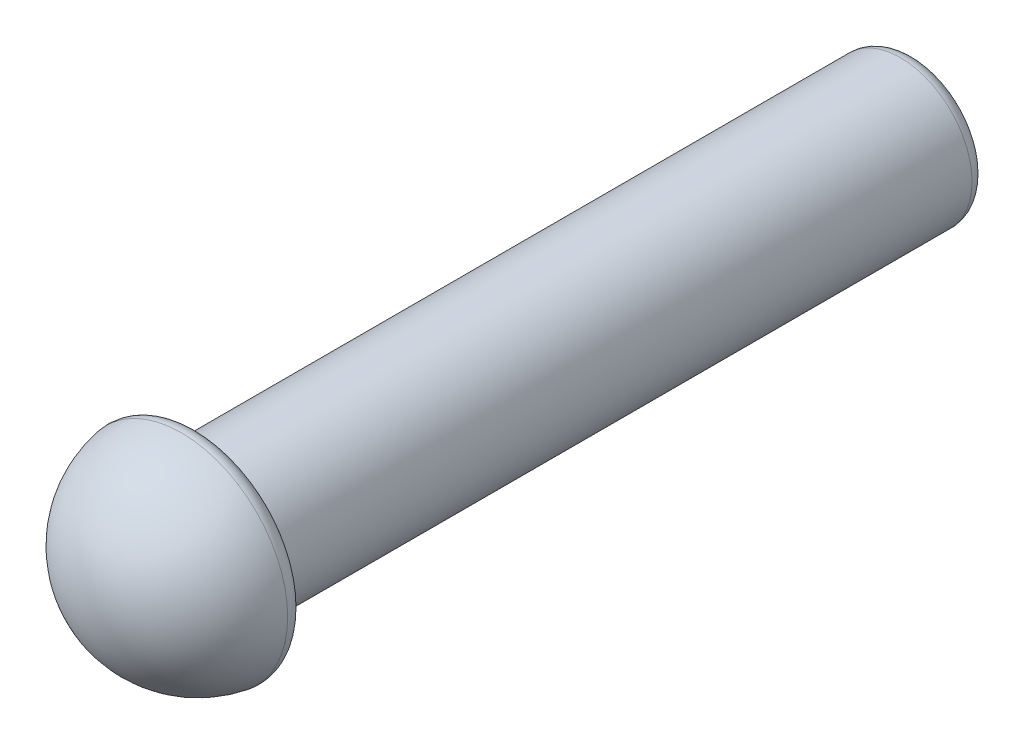
from build123d import *

# Parameters (mm, degrees)
FILLET1_R = 0.508


with BuildPart() as part:
    # Sketch4 → Revolve4 (revolve)
    with BuildSketch(Plane(origin=(0, 0, 0), x_dir=(0, 0, -1), z_dir=(1, 0, 0)), mode=Mode.PRIVATE) as revolve4_sk:
        with BuildLine():
            Line((-3.307050371, 0), (25.4, 0))
            Line((25.4, 0), (25.4, 2.54))
            Line((25.4, 2.54), (0, 2.54))
            Line((0, 2.54), (0, 3.81))
            ThreePointArc((0, 3.81), (-2.694076836, 2.694076836), (-3.81, 0))
            Line((-3.81, 0), (-3.307050371, 0))
        make_face()
    revolve(revolve4_sk.sketch.rotate(Axis((0, 0, 3.307050371), (0, 0, -1)), 90), axis=Axis((0, 0, 3.307050371), (0, 0, -1)))

    # Fillet1
    fillet1_edges = [part.edges().sort_by_distance(p)[0] for p in [
        (-3.81, 0, 0),
        (-2.54, 0, 0),
        (-2.54, 0, -25.4),
    ]]
    fillet(fillet1_edges, radius=FILLET1_R)


solid = part.part
